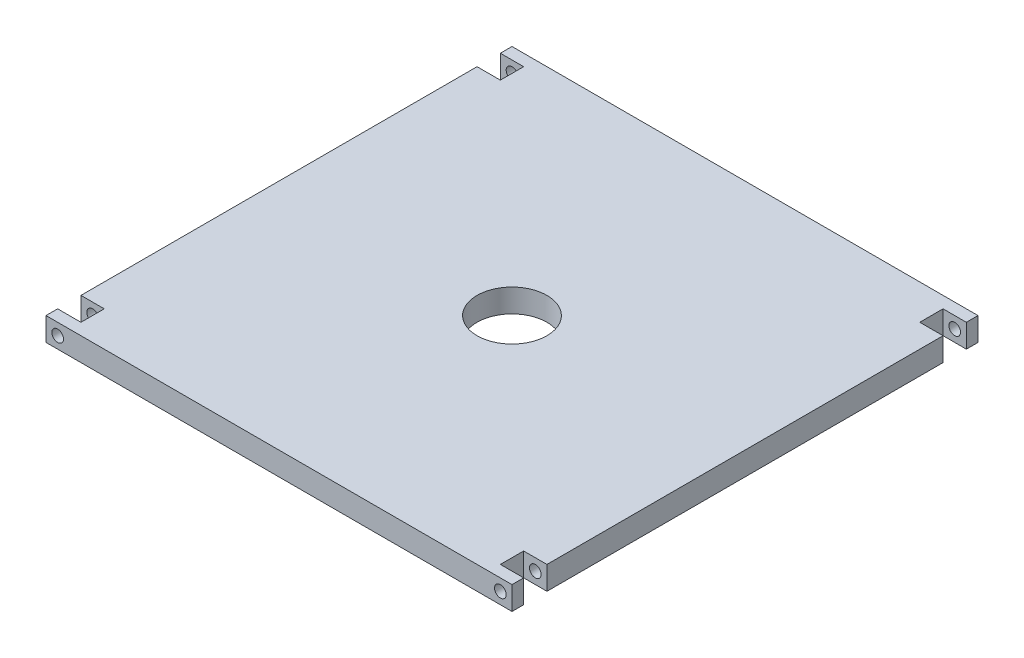
from build123d import *

# Parameters (mm, degrees)
ESQUISSE1_R             = 15
BASE_DEPTH              = 10
ESQUISSE2_R             = 2.5
ENL_V_MAT_EXTRU_1_DEPTH = 224.830292856


with BuildPart() as part:
    # Esquisse1 → BASE (new body)
    with BuildSketch(Plane(origin=(0, 0, 0), x_dir=(1, 0, 0), z_dir=(0, 1, 0))):
        Polygon((-100, 95), (-90, 95), (-90, 85), (-100, 85), (-100, -85), (-90, -85), (-90, -95), (-100, -95), (-100, -100), (-15, -100), (15, -100), (100, -100), (100, -95), (90, -95), (90, -85), (100, -85), (100, 85), (90, 85), (90, 95), (100, 95), (100, 100), (-100, 100), align=None)
        with Locations(Location((0, 0, 0), (0, 0, 270))):
            Circle(ESQUISSE1_R, mode=Mode.SUBTRACT)
    extrude(amount=BASE_DEPTH)

    # Esquisse2 → Enlèv. mat.-Extru.1 (cut, through all)
    with BuildSketch(Plane.XY.offset(100)):
        with Locations((-95, 5)):
            Circle(ESQUISSE2_R)
        with Locations(Location((95, 5, 0), (0, 0, 180))):
            Circle(ESQUISSE2_R)
    extrude(amount=-ENL_V_MAT_EXTRU_1_DEPTH, mode=Mode.SUBTRACT)


solid = part.part
